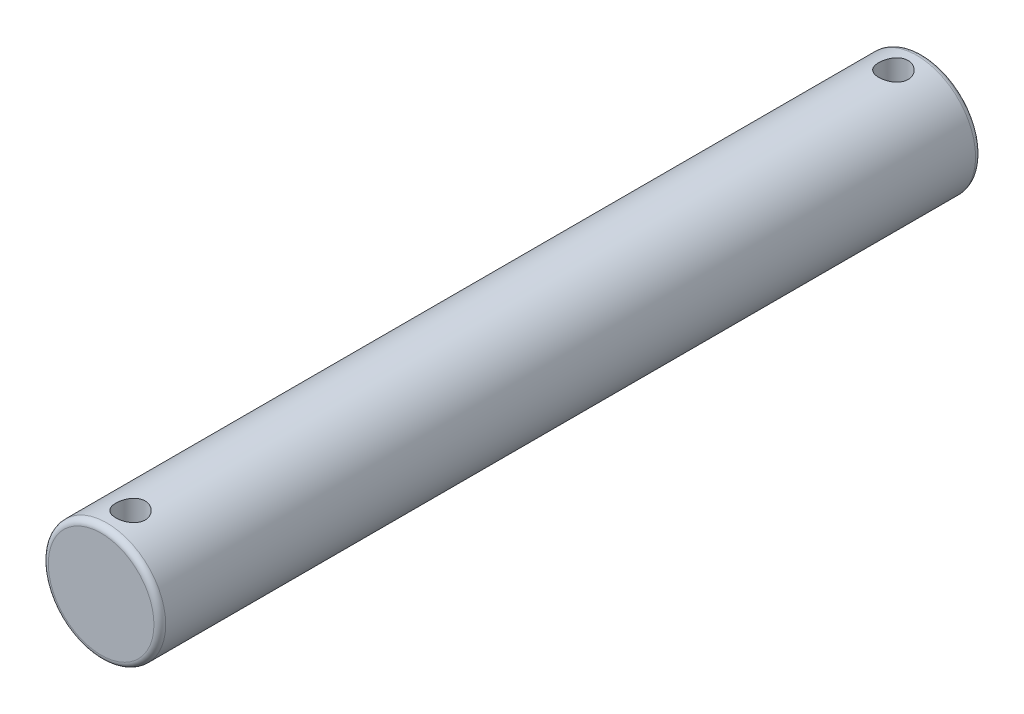
from build123d import *

# Parameters (mm, degrees)
SKETCH1_R               = 10
BOSS_EXTRUDE1_DEPTH     = 140
FILLET1_R               = 1
CUT_EXTRUDE1_DEPTH      = 140
CUT_EXTRUDE1_DEPTH_BACK = 140
SKETCH2_R               = 2.5


with BuildPart() as part:
    # Sketch1 → Boss-Extrude1 (new body)
    with BuildSketch(Plane.XY):
        Circle(SKETCH1_R)
    extrude(amount=BOSS_EXTRUDE1_DEPTH)

    # Fillet1
    fillet1_edges = [part.edges().sort_by_distance(p)[0] for p in [
        (-10, 0, 0),
        (-10, 0, 140),
    ]]
    fillet(fillet1_edges, radius=FILLET1_R)

    # Sketch2 → Cut-Extrude1 (cut, two sides: drawn at the far end of the back side and taken through both)
    with BuildSketch(Plane(origin=(0, 0, 0), x_dir=(1, 0, 0), z_dir=(0, 1, 0)).offset(-CUT_EXTRUDE1_DEPTH_BACK)):
        with Locations((0, -5)):
            Circle(SKETCH2_R)
        with Locations((0, -135)):
            Circle(SKETCH2_R)
    extrude(amount=CUT_EXTRUDE1_DEPTH + CUT_EXTRUDE1_DEPTH_BACK, mode=Mode.SUBTRACT)


solid = part.part
